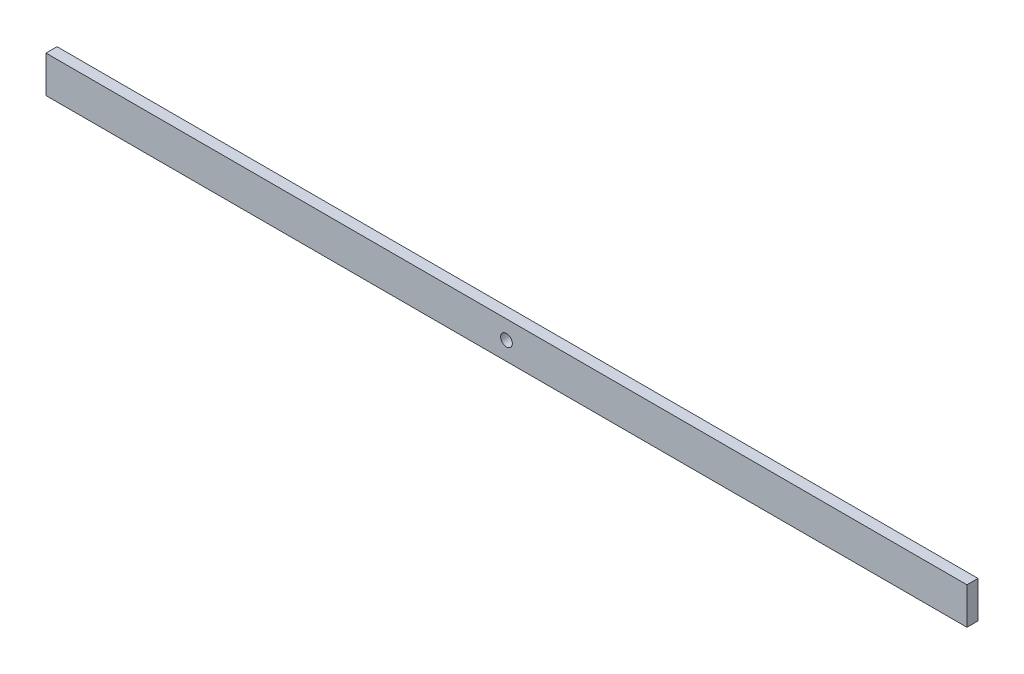
from build123d import *

# Parameters (mm, degrees)
SKETCH1_W           = 250
SKETCH1_H           = 10
SKETCH1_R           = 1.585
BOSS_EXTRUDE1_DEPTH = 3


with BuildPart() as part:
    # Sketch1 → Boss-Extrude1 (new body)
    with BuildSketch(Plane.XY):
        Rectangle(SKETCH1_W, SKETCH1_H)
        Circle(SKETCH1_R, mode=Mode.SUBTRACT)
    extrude(amount=BOSS_EXTRUDE1_DEPTH)


solid = part.part
